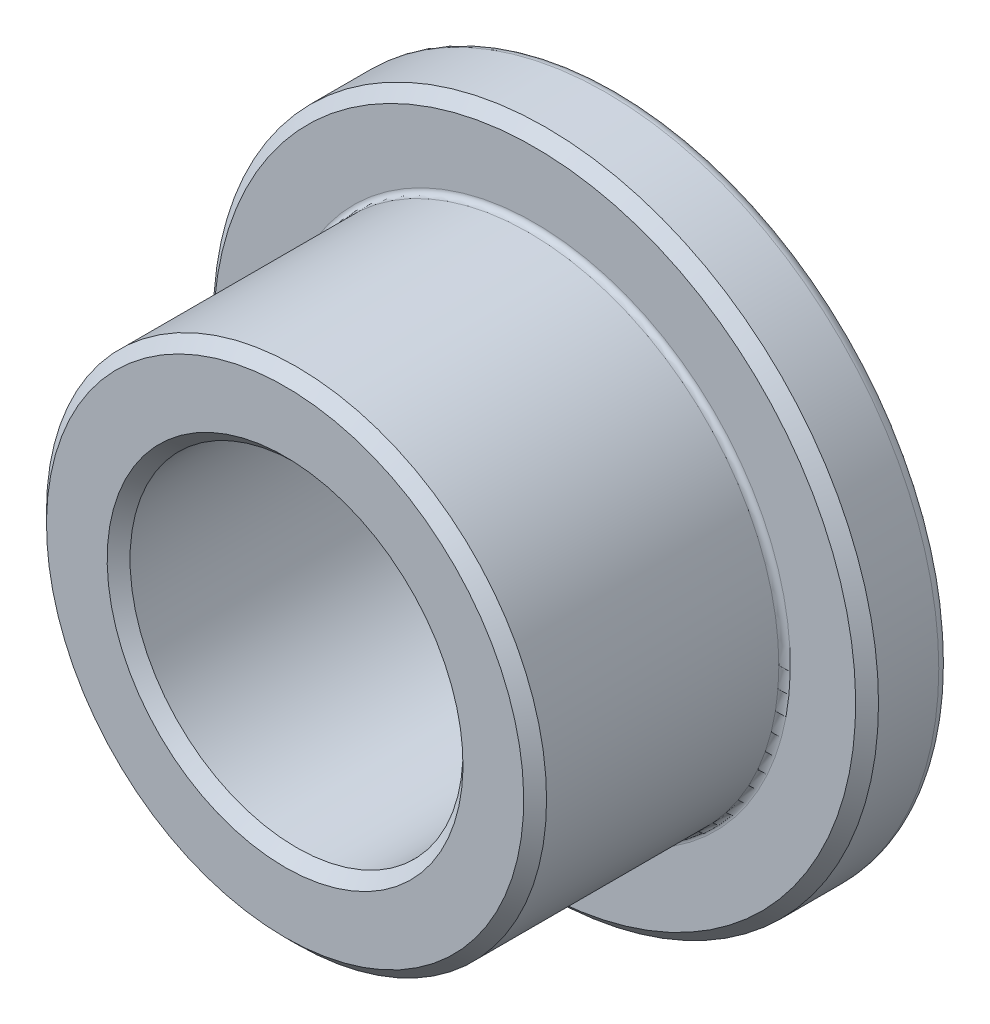
from build123d import *

# Parameters (mm, degrees)
CHAMFER1_SIZE = 0.275
FILLET1_R     = 0.275
FILLET2_R     = 0.1375


with BuildPart() as part:
    # Sketch3 → Revolve1 (revolve)
    with BuildSketch(Plane(origin=(0, 0, 0), x_dir=(0, 0, -1), z_dir=(1, 0, 0))):
        Polygon((4, 8), (2, 8), (2, 6.015), (-4, 6.015), (-4, 4.005), (4, 4.005), align=None)
    revolve(axis=Axis((0, 0, -4), (0, 0, 1)))

    # Chamfer1
    chamfer1_edges = [part.edges().sort_by_distance(p)[0] for p in [
        (0, -4.005, 4),
        (0, -6.015, 4),
        (0, -8, -2),
    ]]
    chamfer(chamfer1_edges, length=CHAMFER1_SIZE)

    # Fillet1
    fillet1_edges = [part.edges().sort_by_distance(p)[0] for p in [
        (0, -8, -4),
    ]]
    fillet(fillet1_edges, radius=FILLET1_R)

    # Fillet2
    fillet2_edges = [part.edges().sort_by_distance(p)[0] for p in [
        (0, -6.015, -2),
    ]]
    fillet(fillet2_edges, radius=FILLET2_R)


solid = part.part
